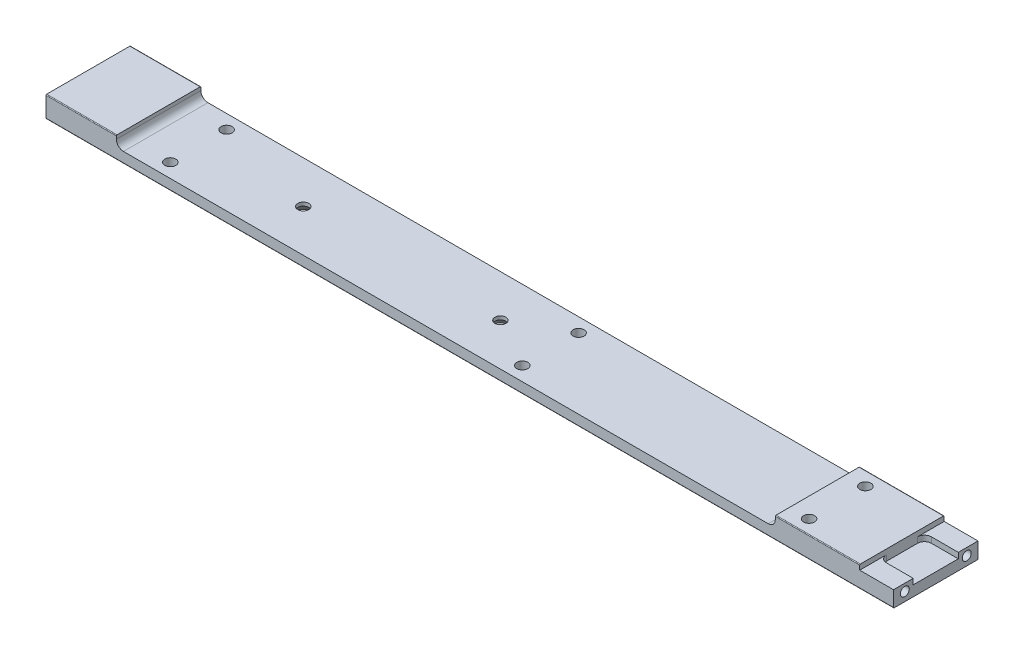
from build123d import *

# Parameters (mm, degrees)
BOSS_EXTRUDE1_DEPTH                    = 4.7625
BOSS_EXTRUDE1_DEPTH_BACK               = 4.7625
SKETCH3_W                              = 382.27
SKETCH3_H                              = 38.1
FILLET1_R                              = 0.314325
TAP_DRILL_FOR_10_32_TAP1_D             = 4.0386
TAP_DRILL_FOR_10_32_TAP1_DEPTH         = 25.4
TAP_DRILL_FOR_10_32_TAP1_TIP           = 1.213317848
TAP_DRILL_FOR_10_32_TAP2_D             = 4.0386
TAP_DRILL_FOR_10_32_TAP2_DEPTH         = 25.4
TAP_DRILL_FOR_10_32_TAP2_TIP           = 1.213317848
SKETCH10_W                             = 15.24
SKETCH10_H                             = 2.286
CUT_EXTRUDE1_DEPTH                     = 195.953531979
F_10_CLEARANCE_HOLE1_D                 = 4.9784
F_10_CLEARANCE_HOLE1_CSINK_D           = 10.4394
F_10_CLEARANCE_HOLE1_CSINK_ANGLE       = 82
CUT_EXTRUDE2_DEPTH                     = 2.54
F_10_CLEARANCE_HOLE2_D                 = 4.9784
F_10_0_1935_DIAMETER_HOLE1_D           = 4.9149
F_10_0_1935_DIAMETER_HOLE1_CSINK_D     = 10.4394
F_10_0_1935_DIAMETER_HOLE1_CSINK_ANGLE = 82


with BuildPart() as part:
    # Sketch3 → Boss-Extrude1 (new, two sides: drawn at the far end of the back side and taken through both)
    with BuildSketch(Plane(origin=(0, 0, 0), x_dir=(1, 0, 0), z_dir=(0, 1, 0)).offset(-BOSS_EXTRUDE1_DEPTH_BACK)):
        Rectangle(SKETCH3_W, SKETCH3_H)
    extrude(amount=BOSS_EXTRUDE1_DEPTH + BOSS_EXTRUDE1_DEPTH_BACK)

    # Fillet1
    fillet1_edges = [part.edges().sort_by_distance(p)[0] for p in [
        (0, 4.7625, 19.05),
        (0, -4.7625, -19.05),
        (0, 4.7625, -19.05),
        (0, -4.7625, 19.05),
    ]]
    fillet(fillet1_edges, radius=FILLET1_R)

    # Tap Drill for #10-32 Tap1
    with Locations(Plane.ZY.offset(191.135)):
        with Locations((-13.97, -0.762), (13.97, -0.762)):
            Hole(TAP_DRILL_FOR_10_32_TAP1_D / 2, depth=TAP_DRILL_FOR_10_32_TAP1_DEPTH)
            with Locations((0, 0, -(TAP_DRILL_FOR_10_32_TAP1_DEPTH + TAP_DRILL_FOR_10_32_TAP1_TIP / 2))):  # 118° drill point
                Cone(0, TAP_DRILL_FOR_10_32_TAP1_D / 2, TAP_DRILL_FOR_10_32_TAP1_TIP, mode=Mode.SUBTRACT)

    # Tap Drill for #10-32 Tap2
    with Locations(Plane(origin=(191.135, 0, 0), x_dir=(0, 0, -1), z_dir=(1, 0, 0))):
        with Locations((-13.97, -0.762), (13.97, -0.762)):
            Hole(TAP_DRILL_FOR_10_32_TAP2_D / 2, depth=TAP_DRILL_FOR_10_32_TAP2_DEPTH)
            with Locations((0, 0, -(TAP_DRILL_FOR_10_32_TAP2_DEPTH + TAP_DRILL_FOR_10_32_TAP2_TIP / 2))):  # 118° drill point
                Cone(0, TAP_DRILL_FOR_10_32_TAP2_D / 2, TAP_DRILL_FOR_10_32_TAP2_TIP, mode=Mode.SUBTRACT)

    # Sketch10 → Cut-Extrude1 (cut, through all)
    with BuildSketch(Plane(origin=(0, 0, -19.05), x_dir=(-1, 0, 0), z_dir=(0, 0, -1))):
        with BuildLine():
            Line((159.385, 4.7625), (159.385, 3.175))
            ThreePointArc((159.385, 3.175), (158.45506403, 0.92993597), (156.21, 0))
            Line((156.21, 0), (-134.62, 0))
            ThreePointArc((-134.62, 0), (-136.86506403, 0.92993597), (-137.795, 3.175))
            Line((-137.795, 3.175), (-137.795, 4.7625))
            Line((-137.795, 4.7625), (159.385, 4.7625))
        make_face()
        with Locations((-183.515, 3.6195)):
            Rectangle(SKETCH10_W, SKETCH10_H)
    extrude(amount=-CUT_EXTRUDE1_DEPTH, mode=Mode.SUBTRACT)

    # #10 Clearance Hole1 (through all)
    with Locations(Plane(origin=(0, -4.7625, 0), x_dir=(-1, 0, 0), z_dir=(0, -1, 0))):
        with Locations((-146.685, 12.7), (-146.685, -12.7)):
            CounterSinkHole(F_10_CLEARANCE_HOLE1_D / 2, F_10_CLEARANCE_HOLE1_CSINK_D / 2, counter_sink_angle=F_10_CLEARANCE_HOLE1_CSINK_ANGLE)

    # Sketch17 → Cut-Extrude2 (cut)
    with BuildSketch(Plane(origin=(0, 2.4765, 0), x_dir=(1, 0, 0), z_dir=(0, 1, 0))):
        with BuildLine():
            Line((191.135, 0), (191.135, 10.16))
            Line((191.135, 10.16), (179.07, 10.16))
            ThreePointArc((179.07, 10.16), (176.82493597, 9.23006403), (175.895, 6.985))
            Line((175.895, 6.985), (175.895, -6.985))
            ThreePointArc((175.895, -6.985), (176.82493597, -9.23006403), (179.07, -10.16))
            Line((179.07, -10.16), (191.135, -10.16))
            Line((191.135, -10.16), (191.135, 0))
        make_face()
    extrude(amount=-CUT_EXTRUDE2_DEPTH, mode=Mode.SUBTRACT)

    # #10 Clearance Hole2 (through all)
    with Locations(Plane(origin=(0, 0, 0), x_dir=(1, 0, 0), z_dir=(0, 1, 0))):
        with Locations((-141.418780002, 12.7), (-141.418780002, -12.7), (17.331219998, 12.7), (17.331219998, -12.7)):
            Hole(F_10_CLEARANCE_HOLE2_D / 2)

    # #10 (0.1935) Diameter Hole1 (through all)
    with Locations(Plane(origin=(0, -4.7625, 0), x_dir=(-1, 0, 0), z_dir=(0, -1, 0))):
        with Locations((94.13370554, 0), (5.23370554, 0)):
            CounterSinkHole(F_10_0_1935_DIAMETER_HOLE1_D / 2, F_10_0_1935_DIAMETER_HOLE1_CSINK_D / 2, counter_sink_angle=F_10_0_1935_DIAMETER_HOLE1_CSINK_ANGLE)


solid = part.part
